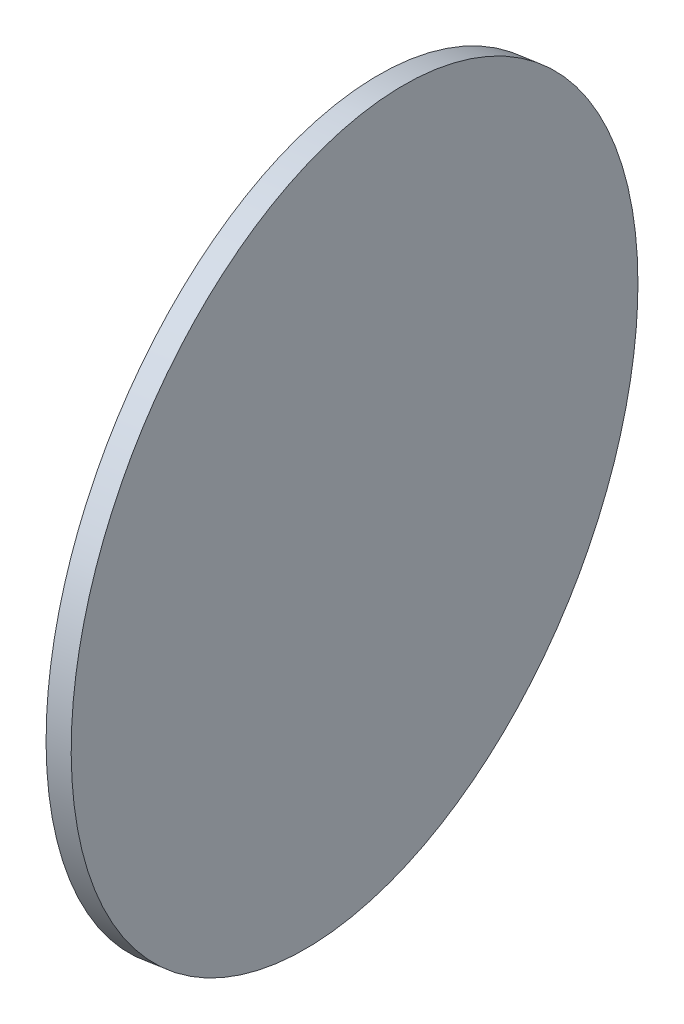
from build123d import *

# Parameters (mm, degrees)
SKETCH4_RX          = 16.110712285
SKETCH4_RY          = 15.875
BOSS_EXTRUDE1_DEPTH = 0.5


with BuildPart() as part:
    # Sketch4 → Boss-Extrude1 (new, symmetric)
    with BuildSketch(Plane(origin=(0, 0, 0), x_dir=(0.17364817766692395, 0, 0.9848077530122092), z_dir=(0.9848077530122081, 4.8018890048418335e-08, -0.17364817766692375))):
        with Locations(Location((0, 0), (0, 0, -179.999984397))):
            Ellipse(SKETCH4_RX, SKETCH4_RY)
    extrude(amount=BOSS_EXTRUDE1_DEPTH, both=True)


solid = part.part
